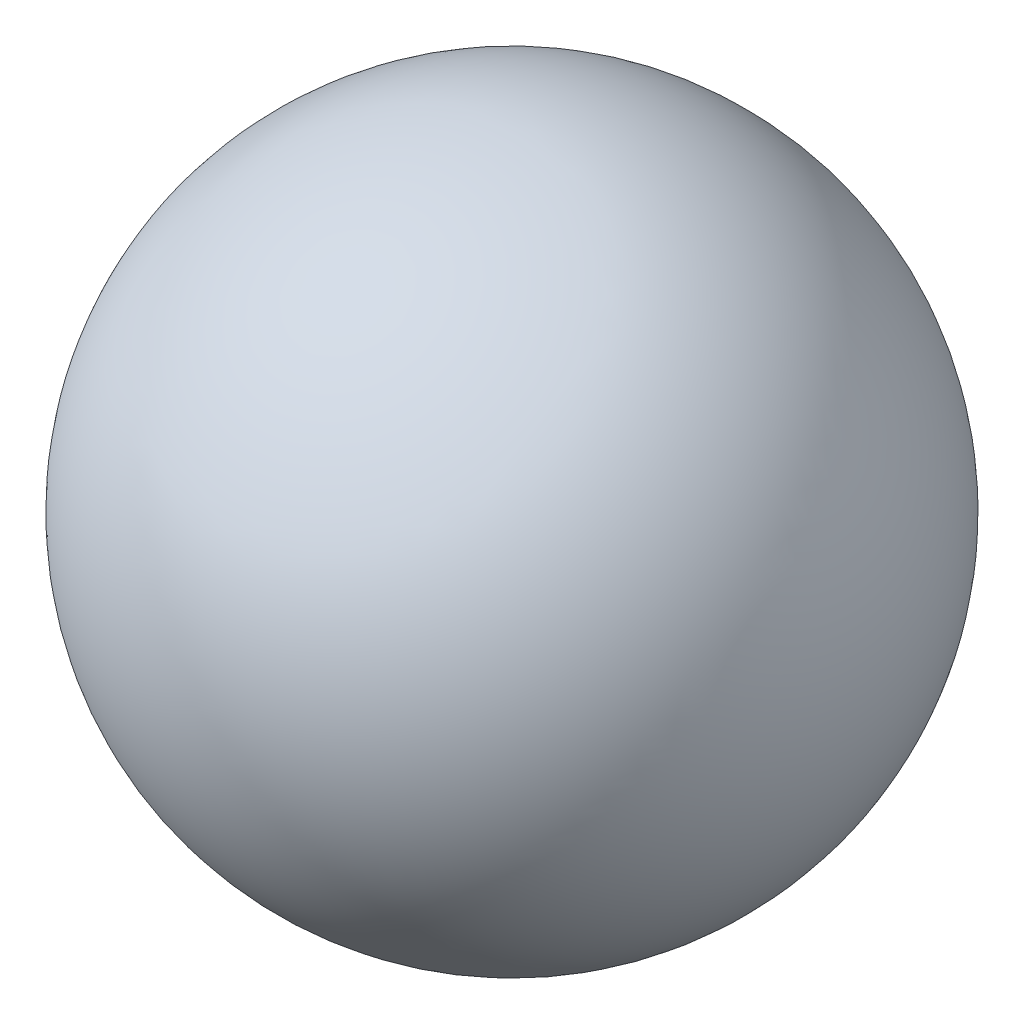
from build123d import *


with BuildPart() as part:
    # Sketch1 → Revolve1 (revolve)
    with BuildSketch(Plane.XY):
        with BuildLine():
            Line((-20.32, 0), (20.32, 0))
            ThreePointArc((20.32, 0), (0, 20.32), (-20.32, 0))
        make_face()
    revolve(axis=Axis((-20.32, 0, 0), (1, 0, 0)))


solid = part.part
